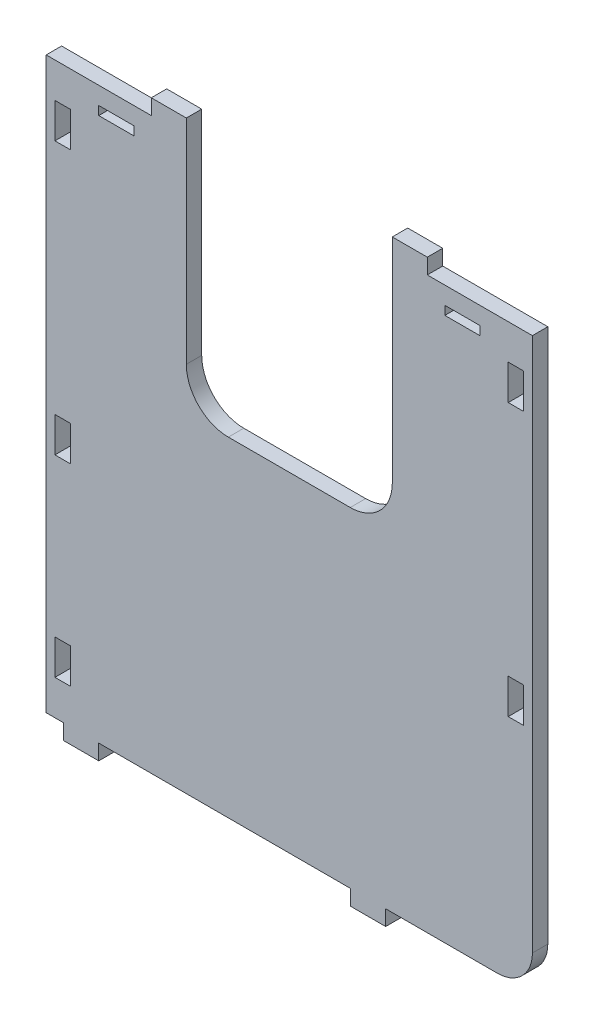
from build123d import *

# Parameters (mm, degrees)
BOSS_EXTRUDE1_DEPTH = 2.794
FILLET1_R           = 7.62
SKETCH2_W           = 6.35
SKETCH2_H           = 1.5875
SKETCH2_W_2         = 2.794
SKETCH2_H_2         = 6.35
CUT_EXTRUDE1_DEPTH  = 127.827697441
FILLET2_R           = 6.35


with BuildPart() as part:
    # Sketch1 → Boss-Extrude1 (new body)
    with BuildSketch(Plane.XY):
        Polygon((18.662640042, 103.275), (-0.387359958, 103.275), (-0.387359958, 106.069), (-6.737359958, 106.069), (-6.737359958, 59.782284891), (-44.075359958, 59.782284891), (-44.075359958, 106.069), (-50.425359958, 106.069), (-50.425359958, 103.275), (-69.475359958, 103.275), (-69.475359958, 0), (-66.300359958, 0), (-66.300359958, -2.794), (-59.950359958, -2.794), (-59.950359958, 0), (-14.2875, 0), (-14.2875, -2.794), (-7.9375, -2.794), (-7.9375, 0), (18.662640042, 0), align=None)
    extrude(amount=BOSS_EXTRUDE1_DEPTH)

    # Fillet1
    fillet1_edges = [part.edges().sort_by_distance(p)[0] for p in [
        (-44.075359958, 59.782284891, 1.397),
        (-6.737359958, 59.782284891, 1.397),
    ]]
    fillet(fillet1_edges, radius=FILLET1_R)

    # Sketch2 → Cut-Extrude1 (cut, through all)
    with BuildSketch(Plane.XY.offset(2.794)):
        with Locations((-56.775359958, 99.30625)):
            Rectangle(SKETCH2_W, SKETCH2_H)
        with Locations((5.962640042, 99.30625)):
            Rectangle(SKETCH2_W, SKETCH2_H)
        with Locations((15.678140042, 44.45)):
            Rectangle(SKETCH2_W_2, SKETCH2_H_2)
        with Locations((15.678140042, 93.75)):
            Rectangle(SKETCH2_W_2, SKETCH2_H_2)
        with Locations((-66.490859958, 93.75)):
            Rectangle(SKETCH2_W_2, SKETCH2_H_2)
        with Locations((-66.490859958, 44.45)):
            Rectangle(SKETCH2_W_2, SKETCH2_H_2)
        with Locations((-66.490859958, 9.525)):
            Rectangle(SKETCH2_W_2, SKETCH2_H_2)
    extrude(amount=-CUT_EXTRUDE1_DEPTH, mode=Mode.SUBTRACT)

    # Fillet2
    fillet2_edges = [part.edges().sort_by_distance(p)[0] for p in [
        (18.662640042, 0, 1.397),
    ]]
    fillet(fillet2_edges, radius=FILLET2_R)


solid = part.part
